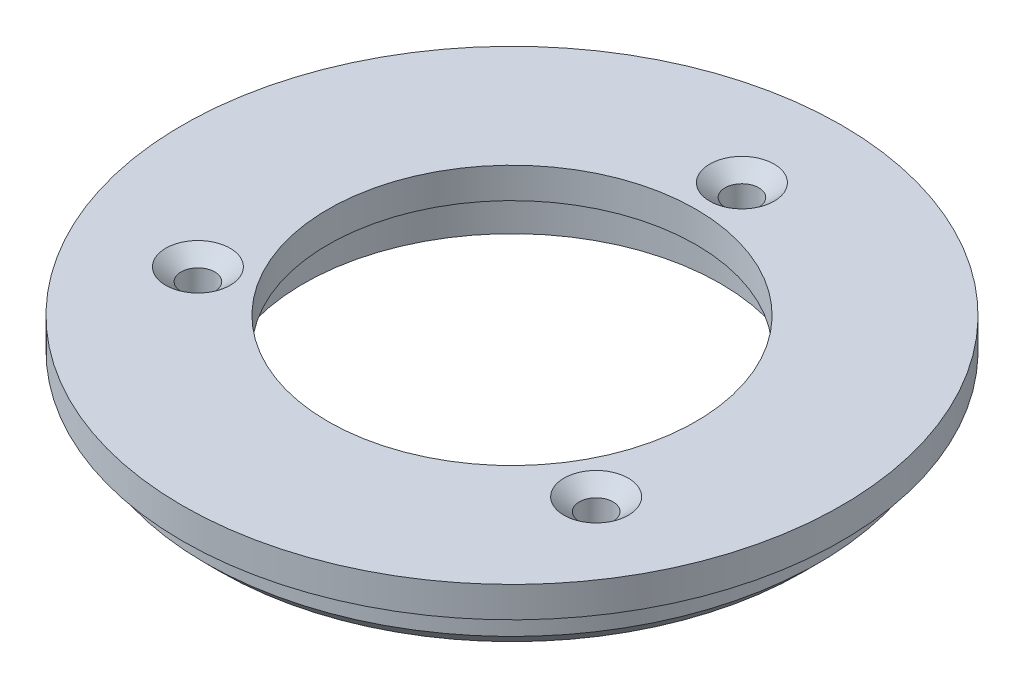
from build123d import *

# Parameters (mm, degrees)
SKETCH1_R                                         = 21.5
SKETCH1_R_2                                       = 12
BOSS_EXTRUDE1_DEPTH                               = 2
SKETCH2_R                                         = 20
SKETCH2_R_2                                       = 13.6
BOSS_EXTRUDE2_DEPTH                               = 3
CHAMFER1_SIZE                                     = 1
CSK_FOR_0_FLAT_HEAD_MACHINE_SCREW_100_D           = 2.199999918
CSK_FOR_0_FLAT_HEAD_MACHINE_SCREW_100_CSINK_D     = 4.199999982
CSK_FOR_0_FLAT_HEAD_MACHINE_SCREW_100_CSINK_ANGLE = 100


with BuildPart() as part:
    # Sketch1 → Boss-Extrude1 (new body)
    with BuildSketch(Plane(origin=(0, 0, 0), x_dir=(1, 0, 0), z_dir=(0, 1, 0))):
        with Locations(Location((0, 0, 0), (0, 0, 270))):
            Circle(SKETCH1_R)
        with Locations(Location((0, 0, 0), (0, 0, 270))):
            Circle(SKETCH1_R_2, mode=Mode.SUBTRACT)
    extrude(amount=-BOSS_EXTRUDE1_DEPTH)

    # Sketch2 → Boss-Extrude2 (add)
    with BuildSketch(Plane.XZ.offset(2)):
        with Locations(Location((0, 0, 0), (0, 0, 270))):
            Circle(SKETCH2_R)
        with Locations(Location((0, 0, 0), (0, 0, 270))):
            Circle(SKETCH2_R_2, mode=Mode.SUBTRACT)
    extrude(amount=BOSS_EXTRUDE2_DEPTH)

    # Chamfer1
    chamfer1_edges = [part.edges().sort_by_distance(p)[0] for p in [
        (0, -5, 20),
    ]]
    chamfer(chamfer1_edges, length=CHAMFER1_SIZE)

    # CSK for #0 Flat Head Machine Screw (100)1 (through all)
    with Locations(Plane(origin=(0, 0, 0), x_dir=(1, 0, 0), z_dir=(0, 1, 0))):
        with Locations((0, 15), (12.990381057, -7.5), (-12.990381057, -7.5)):
            CounterSinkHole(CSK_FOR_0_FLAT_HEAD_MACHINE_SCREW_100_D / 2, CSK_FOR_0_FLAT_HEAD_MACHINE_SCREW_100_CSINK_D / 2, counter_sink_angle=CSK_FOR_0_FLAT_HEAD_MACHINE_SCREW_100_CSINK_ANGLE)


solid = part.part
